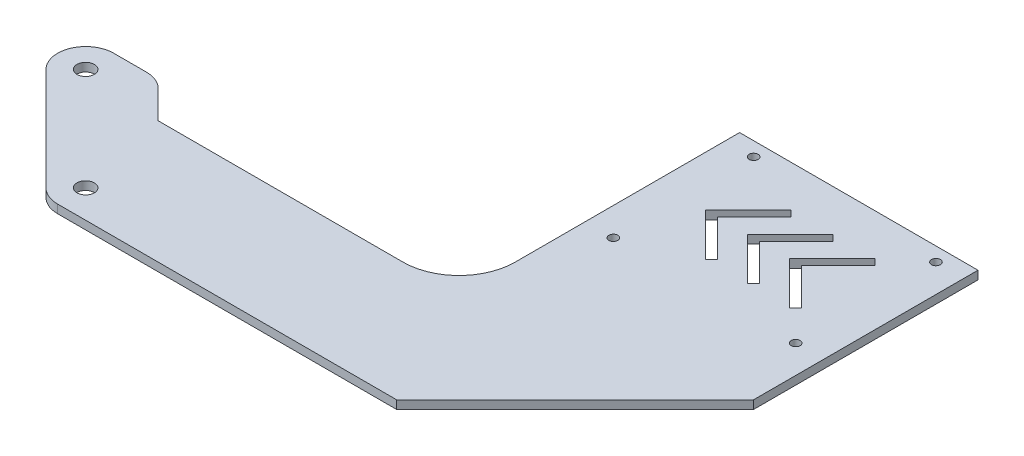
from build123d import *

# Parameters (mm, degrees)
SKETCH_1_W            = 85
SKETCH_1_H            = 60
SKETCH_1_R            = 1.6
EXTRUDE_1_DEPTH       = 3
EXTRUDE_2_DEPTH       = 3
FILLET_1_R            = 20
FILLET_3_R            = 10
SKETCH_4_R            = 3.1
CUT_EXTRUDE_1_DEPTH   = 10
CUT_EXTRUDE_1_2_DEPTH = 10


with BuildPart() as part:
    # 草图1 → 凸台-拉伸1 (new body)
    with BuildSketch(Plane(origin=(0, 0, 0), x_dir=(1, 0, 0), z_dir=(0, 1, 0))):
        with Locations((32.5, 25)):
            Rectangle(SKETCH_1_W, SKETCH_1_H)
        with Locations(Location((0, 50, 0), (0, 0, 270))):
            Circle(SKETCH_1_R, mode=Mode.SUBTRACT)
        with Locations(Location((65, 50, 0), (0, 0, 90))):
            Circle(SKETCH_1_R, mode=Mode.SUBTRACT)
        with Locations(Location((65, 0, 0), (0, 0, 270))):
            Circle(SKETCH_1_R, mode=Mode.SUBTRACT)
        with Locations(Location((0, 0, 0), (0, 0, 90))):
            Circle(SKETCH_1_R, mode=Mode.SUBTRACT)
    extrude(amount=EXTRUDE_1_DEPTH)

    # 草图2 → 凸台-拉伸2 (add)
    with BuildSketch(Plane(origin=(0, 0, 0), x_dir=(1, 0, 0), z_dir=(0, 1, 0))):
        Polygon((-10, -5), (75, -5), (75, -25), (11.360389693, -88.639610307), (-58.172444533, -88.639610307), (-113.639610307, -88.639610307), (-157.279220614, -45), (-170.208152802, -32.071067812), (-130.208152802, -32.071067812), (-117.279220614, -45), (-10, -45), align=None)
    extrude(amount=EXTRUDE_2_DEPTH)

    # 圆角1
    fillet_1_edges = [part.edges().sort_by_distance(p)[0] for p in [
        (-10, 1.5, 45),
    ]]
    fillet(fillet_1_edges, radius=FILLET_1_R)

    # 圆角3
    fillet_3_edges = [part.edges().sort_by_distance(p)[0] for p in [
        (-130.208152802, 1.5, 32.071067812),
        (-170.208152802, 1.5, 32.071067812),
        (-113.639610307, 1.5, 88.639610307),
    ]]
    fillet(fillet_3_edges, radius=FILLET_3_R)

    # 草图4 → Cut-Extrude 1 (cut)
    with BuildSketch(Plane(origin=(0, 3, 0), x_dir=(1, 0, 0), z_dir=(0, 1, 0))):
        with Locations(Location((-146.066017178, -42.071067812, 0), (0, 0, 270))):
            Circle(SKETCH_4_R)
        with Locations(Location((-109.497474683, -78.639610307, 0), (0, 0, 270))):
            Circle(SKETCH_4_R)
    extrude(amount=-CUT_EXTRUDE_1_DEPTH, mode=Mode.SUBTRACT)

    # 草图5 → Cut-Extrude 1 2 (cut)
    with BuildSketch(Plane(origin=(0, 3, 0), x_dir=(1, 0, 0), z_dir=(0, 1, 0))):
        Polygon((25.202795796, 11.918524548), (12.121320344, 25), (25.202795796, 38.081475452), (23.081475452, 40.202795796), (7.878679656, 25), (23.081475452, 9.797204204), align=None)
        Polygon((40.202795796, 11.918524548), (27.121320344, 25), (40.202795796, 38.081475452), (38.081475452, 40.202795796), (22.878679656, 25), (38.081475452, 9.797204204), align=None)
        Polygon((55.202795796, 11.918524548), (42.121320344, 25), (55.202795796, 38.081475452), (53.081475452, 40.202795796), (37.878679656, 25), (53.081475452, 9.797204204), align=None)
    extrude(amount=-CUT_EXTRUDE_1_2_DEPTH, mode=Mode.SUBTRACT)


solid = part.part
